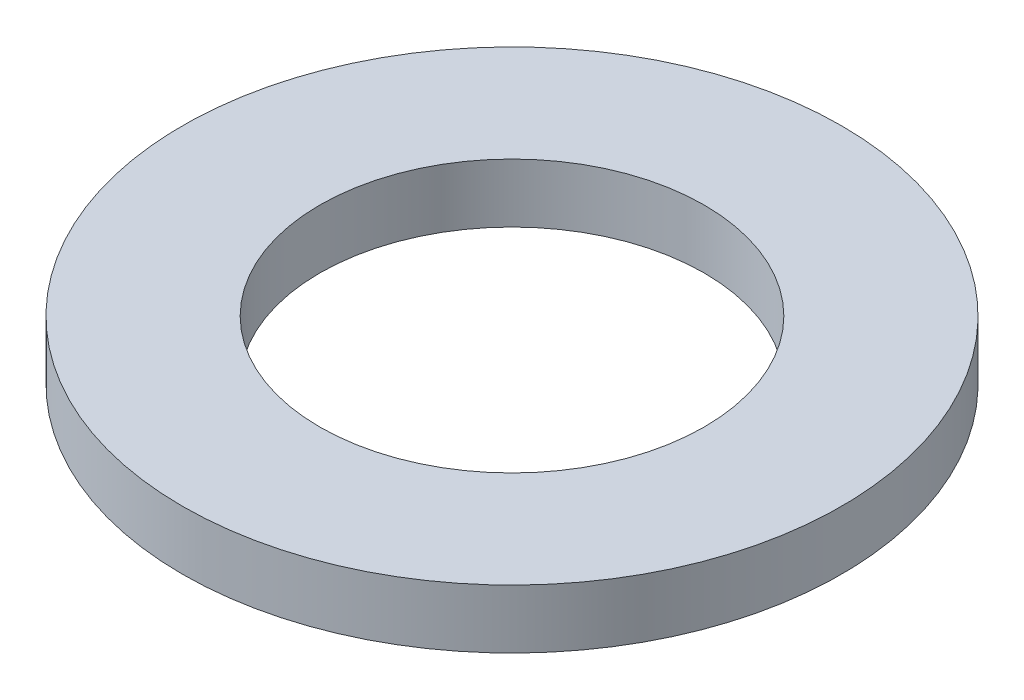
from build123d import *

# Parameters (mm, degrees)
SKETCH1_R           = 19.05
BOSS_EXTRUDE1_DEPTH = 3.4036
SKETCH5_R           = 11.1125
CUT_EXTRUDE1_DEPTH  = 28.154916552


with BuildPart() as part:
    # Sketch1 → Boss-Extrude1 (new body)
    with BuildSketch(Plane(origin=(0, 0, 0), x_dir=(1, 0, 0), z_dir=(0, 1, 0))):
        with Locations(Location((0, 0, 0), (0, 0, 270))):
            Circle(SKETCH1_R)
    extrude(amount=BOSS_EXTRUDE1_DEPTH)

    # Sketch5 → Cut-Extrude1 (cut, through all)
    with BuildSketch(Plane(origin=(0, 3.4036, 0), x_dir=(-1, 0, 0), z_dir=(0, 1, 0))):
        with Locations(Location((0, 0, 0), (0, 0, 90))):
            Circle(SKETCH5_R)
    extrude(amount=-CUT_EXTRUDE1_DEPTH, mode=Mode.SUBTRACT)


solid = part.part
